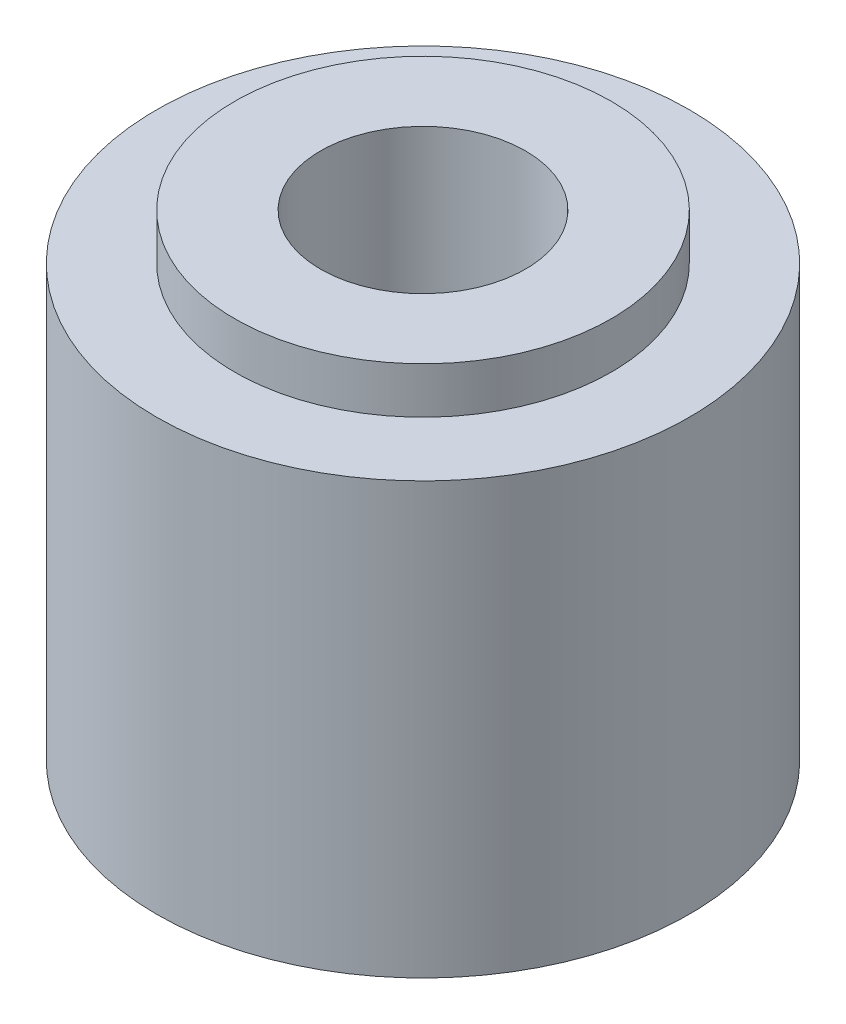
from build123d import *

# Parameters (mm, degrees)
SKETCH_1_R      = 49.5
SKETCH_1_R_2    = 19.05
EXTRUDE_1_DEPTH = 80
SKETCH_2_R      = 35
SKETCH_2_R_2    = 19.05
EXTRUDE_2_DEPTH = 8.6


with BuildPart() as part:
    # 草图1 → 凸台-拉伸1 (new body)
    with BuildSketch(Plane(origin=(0, 0, 0), x_dir=(1, 0, 0), z_dir=(0, 1, 0))):
        with Locations(Location((0, 0, 0), (0, 0, 270))):
            Circle(SKETCH_1_R)
        with Locations(Location((0, 0, 0), (0, 0, 270))):
            Circle(SKETCH_1_R_2, mode=Mode.SUBTRACT)
    extrude(amount=EXTRUDE_1_DEPTH)

    # 草图2 → 凸台-拉伸2 (add)
    with BuildSketch(Plane(origin=(0, 80, 0), x_dir=(1, 0, 0), z_dir=(0, 1, 0))):
        with Locations(Location((0, 0, 0), (0, 0, 90))):
            Circle(SKETCH_2_R)
        with Locations(Location((0, 0, 0), (0, 0, 270))):
            Circle(SKETCH_2_R_2, mode=Mode.SUBTRACT)
    extrude(amount=EXTRUDE_2_DEPTH)


solid = part.part
